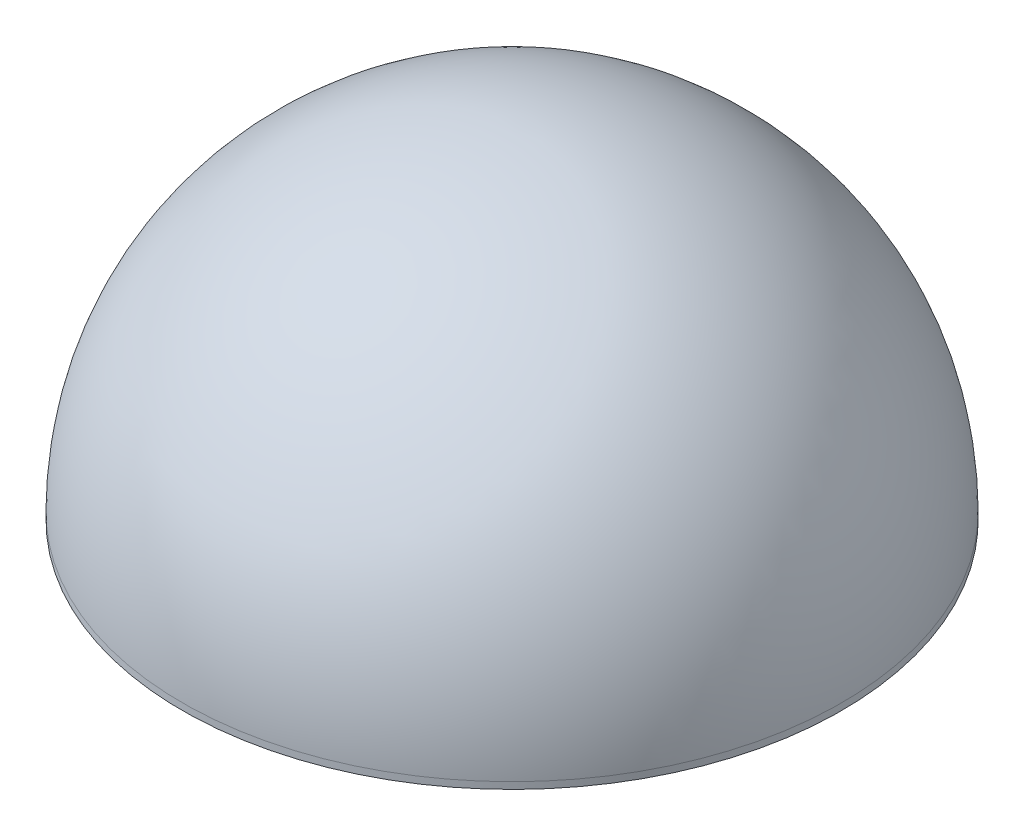
from build123d import *

# Parameters (mm, degrees)
SKETCH2_R          = 1.5
CUT_EXTRUDE1_DEPTH = 3.175


with BuildPart() as part:
    # Sketch1 → Revolve1 (revolve)
    with BuildSketch(Plane.XY, mode=Mode.PRIVATE) as revolve1_sk:
        with BuildLine():
            Line((0, 0), (-6.223, 0))
            Line((-6.223, 0), (-6.223, 0.127))
            ThreePointArc((-6.223, 0.127), (-4.400325499, 4.527325499), (0, 6.35))
            Line((0, 6.35), (0, 0))
        make_face()
    revolve(revolve1_sk.sketch.rotate(Axis((0, 0, 0), (0, 1, 0)), 270), axis=Axis((0, 0, 0), (0, 1, 0)))

    # Sketch2 → Cut-Extrude1 (cut)
    with BuildSketch(Plane.XZ):
        with Locations(Location((0, 0, 0), (0, 0, 270))):
            Circle(SKETCH2_R)
    extrude(amount=-CUT_EXTRUDE1_DEPTH, mode=Mode.SUBTRACT)


solid = part.part
